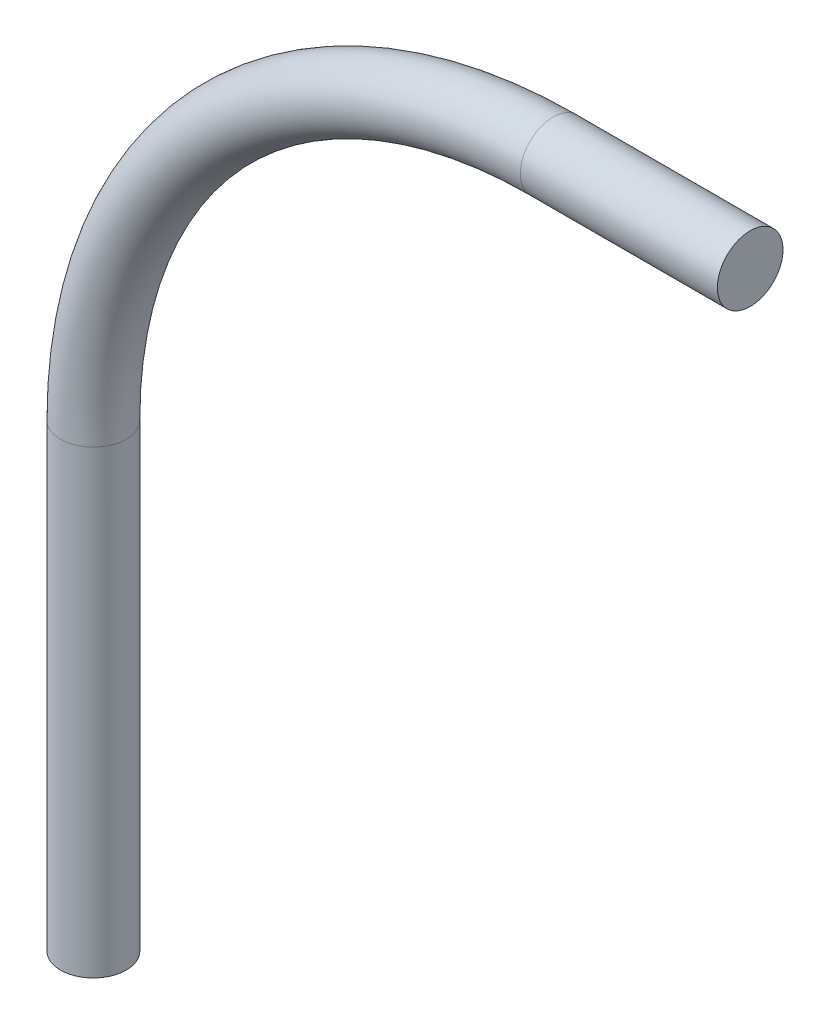
from build123d import *

# Parameters (mm, degrees)
SKETCH3_R = 2.5


with BuildPart() as part:
    # Sweep2: sweep along a path in Sketch1
    with BuildLine(Plane.XY) as sweep2_path:
        Line((0, 0), (0, 35))
        ThreePointArc((0, 35), (10.251262658, 59.748737342), (35, 70))
        Line((35, 70), (50, 70))
    # Sketch3 → Sweep2 (sweep)
    with BuildSketch(Plane(origin=(0, 0, 0), x_dir=(1, 0, 0), z_dir=(0, 1, 0))):
        Circle(SKETCH3_R)
    sweep(path=sweep2_path.line)


solid = part.part
